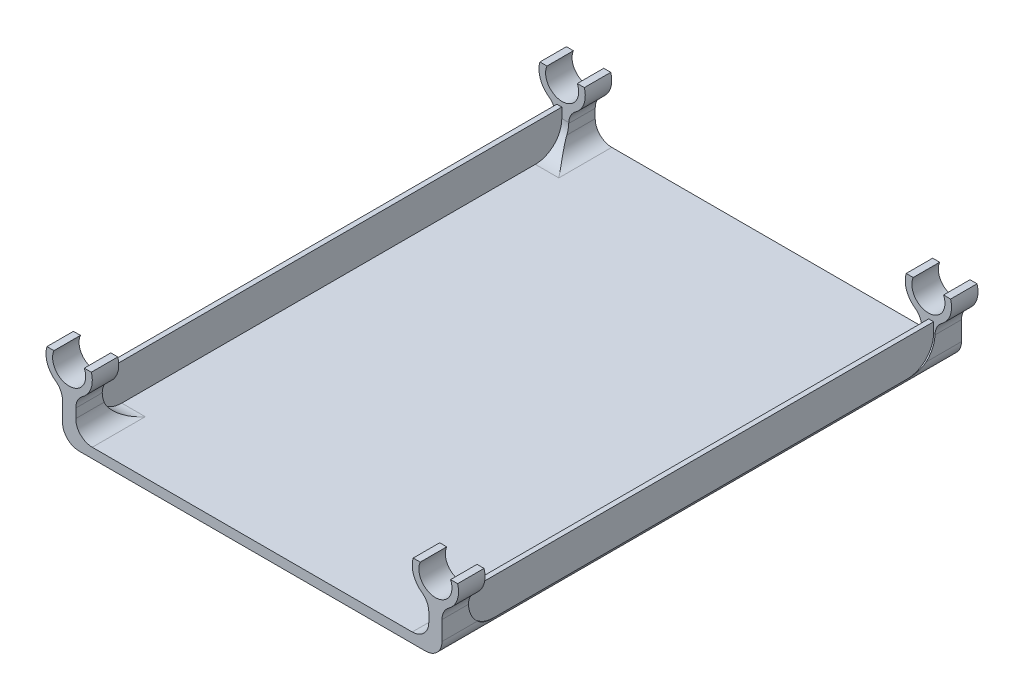
from build123d import *

# Parameters (mm, degrees)
BOSS_EXTRUDE1_DEPTH     = 157
FILLET1_R               = 5
CUT_EXTRUDE1_DEPTH      = 199.704151945
CUT_EXTRUDE1_DEPTH_BACK = 199.704151945
SKETCH2_W               = 141
SKETCH2_H               = 19.5
FILLET5_R               = 8
SKETCH4_W               = 1.487907189
SKETCH4_H               = 11
BOSS_EXTRUDE5_DEPTH     = 141


with BuildPart() as part:
    # Sketch1 → Boss-Extrude1 (new body)
    with BuildSketch(Plane.XY):
        with BuildLine():
            Line((-110.7, 13.791796068), (-110.7, 3))
            Line((-110.7, 3), (-4, 3))
            Line((-4, 3), (-4, 13.791796068))
            ThreePointArc((-4, 13.791796068), (-8.157630053, 17.170797072), (-8.708203932, 22.5))
            Line((-8.708203932, 22.5), (-6.582575695, 22.5))
            ThreePointArc((-6.582575695, 22.5), (-2, 15.5), (2.582575695, 22.5))
            Line((2.582575695, 22.5), (4.708203932, 22.5))
            ThreePointArc((4.708203932, 22.5), (4.157630053, 17.170797072), (0, 13.791796068))
            Line((0, 13.791796068), (0, 2))
            Line((0, 2), (0, 0))
            Line((0, 0), (-114.7, 0))
            Line((-114.7, 0), (-114.7, 2))
            Line((-114.7, 2), (-114.7, 13.791796068))
            ThreePointArc((-114.7, 13.791796068), (-118.857630053, 17.170797072), (-119.408203932, 22.5))
            Line((-119.408203932, 22.5), (-117.282575695, 22.5))
            ThreePointArc((-117.282575695, 22.5), (-112.7, 15.5), (-108.117424305, 22.5))
            Line((-108.117424305, 22.5), (-105.991796068, 22.5))
            ThreePointArc((-105.991796068, 22.5), (-106.542369947, 17.170797072), (-110.7, 13.791796068))
        make_face()
    extrude(amount=BOSS_EXTRUDE1_DEPTH)

    # Fillet1
    fillet1_edges = [part.edges().sort_by_distance(p)[0] for p in [
        (-110.7, 3, 78.5),
        (-4, 3, 78.5),
        (-4, 13.791796068, 78.5),
        (0, 13.791796068, 78.5),
        (0, 0, 78.5),
        (-114.7, 0, 78.5),
        (-114.7, 13.791796068, 78.5),
        (-110.7, 13.791796068, 78.5),
    ]]
    fillet(fillet1_edges, radius=FILLET1_R)

    # Sketch2 → Cut-Extrude1 (cut, two sides: drawn at the far end of the back side and taken through both)
    with BuildSketch(Plane.ZY.offset(114.7).offset(-CUT_EXTRUDE1_DEPTH_BACK)):
        with Locations((78.5, 12.75)):
            Rectangle(SKETCH2_W, SKETCH2_H)
    extrude(amount=CUT_EXTRUDE1_DEPTH + CUT_EXTRUDE1_DEPTH_BACK, mode=Mode.SUBTRACT)

    # Fillet5
    fillet5_edges = [part.edges().sort_by_distance(p)[0] for p in [
        (-4.708712153, 3, 8),
        (-4.708712153, 3, 149),
        (-109.991287847, 3, 149),
        (-109.991287847, 3, 8),
    ]]
    fillet(fillet5_edges, radius=FILLET5_R)

    # Sketch4 → Boss-Extrude5 (add)
    with BuildSketch(Plane.XY.offset(8)):
        with Locations((-113.538622101, 8.5)):
            Rectangle(SKETCH4_W, SKETCH4_H)
        with Locations((-1.1613779, 8.5)):
            Rectangle(SKETCH4_W, SKETCH4_H)
    extrude(amount=BOSS_EXTRUDE5_DEPTH)


solid = part.part
